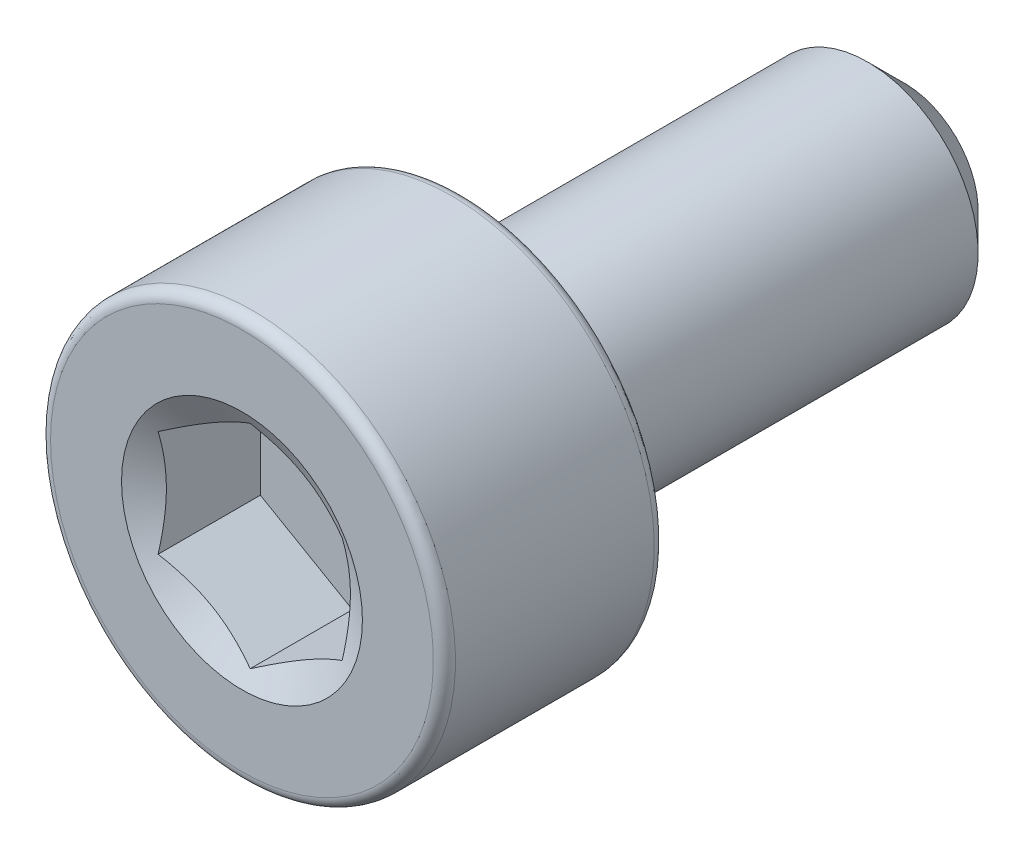
from build123d import *

# Parameters (mm, degrees)
CUT_EXTRUDE1_START = 4.5
CUT_EXTRUDE1_DEPTH = 1.5


with BuildPart() as part:
    # Sketch2 → Revolve1 (revolve)
    with BuildSketch(Plane(origin=(0, 0, 0), x_dir=(0, 0, -1), z_dir=(1, 0, 0)), mode=Mode.PRIVATE) as revolve1_sk:
        with BuildLine():
            Line((4.5, 0), (4.5, 1))
            Line((4.5, 1), (4, 1.5))
            Line((4, 1.5), (-1.5, 1.5))
            Line((-1.5, 1.5), (-1.5, 2.6))
            ThreePointArc((-1.5, 2.6), (-1.543933983, 2.706066017), (-1.65, 2.75))
            Line((-1.65, 2.75), (-4.35, 2.75))
            ThreePointArc((-4.35, 2.75), (-4.456066017, 2.706066017), (-4.5, 2.6))
            Line((-4.5, 2.6), (-4.5, 0))
            Line((-4.5, 0), (4.5, 0))
        make_face()
    revolve(revolve1_sk.sketch.rotate(Axis((0, 0, -4.5), (0, 0, 1)), 90), axis=Axis((0, 0, -4.5), (0, 0, 1)))

    # Sketch3 → Cut-Extrude1 (cut)
    with BuildSketch(Plane.XY.offset(CUT_EXTRUDE1_START)):
        Polygon((-1.25, 0.721687836), (-1.25, -0.721687836), (0, -1.443375673), (1.25, -0.721687836), (1.25, 0.721687836), (0, 1.443375673), align=None)
    extrude(amount=-CUT_EXTRUDE1_DEPTH, mode=Mode.SUBTRACT)

    # Cut-Extrude2 cone 1 section (through the dimple's axis) → Cut-Extrude2 (revolve, cut)
    with BuildSketch(Plane(origin=(0, 0, 4.5), x_dir=(0, -1, 0), z_dir=(1, 0, 0))):
        Polygon((0, 0), (1.636146394, 0), (0, 0.944629561), align=None)
    revolve(axis=Axis((0, 0, 4.5), (0, 0, -1)), mode=Mode.SUBTRACT)


solid = part.part
